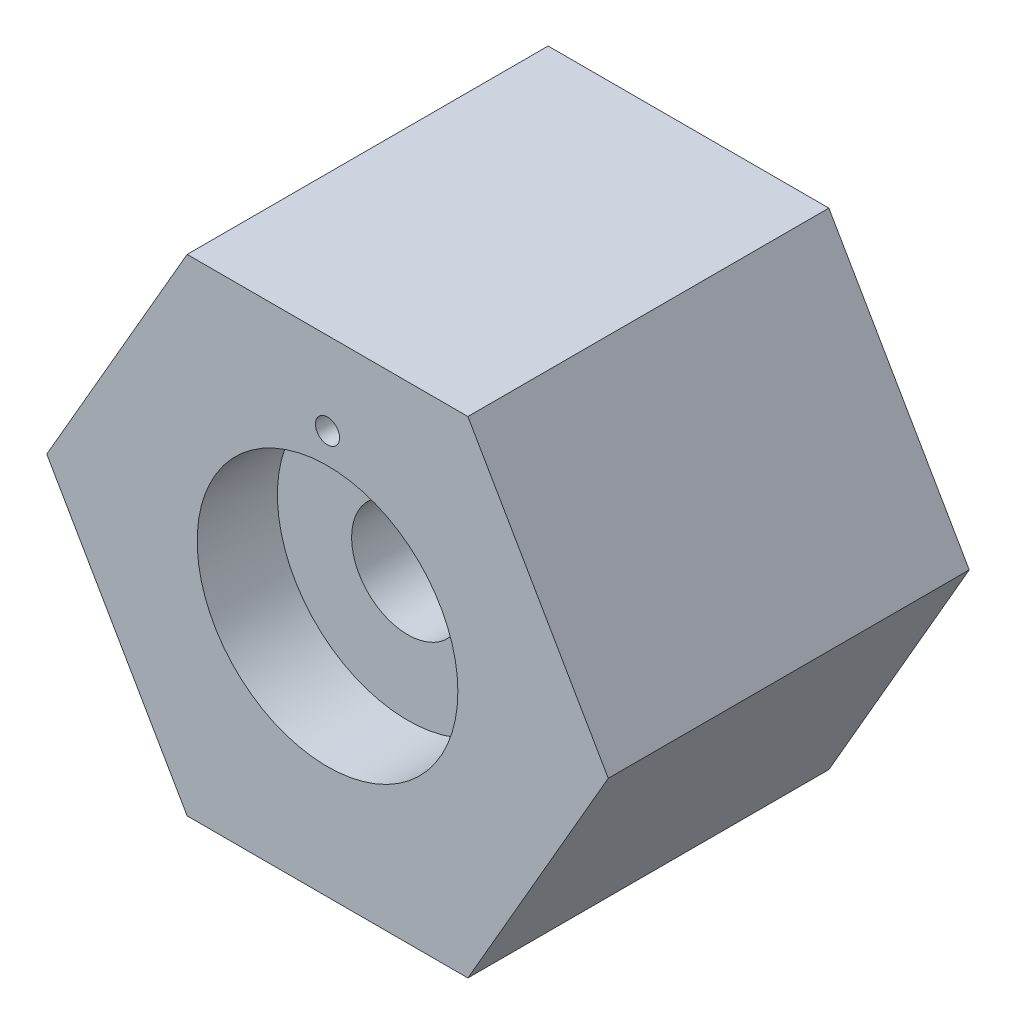
from build123d import *

# Parameters (mm, degrees)
BOSS_EXTRUDE1_DEPTH = 22.5
SKETCH2_R           = 16.25
CUT_EXTRUDE1_DEPTH  = 10
SKETCH3_R           = 7
CUT_EXTRUDE2_DEPTH  = 25
SKETCH4_R           = 1.5
CUT_EXTRUDE4_DEPTH  = 10


with BuildPart() as part:
    # Sketch1 → Boss-Extrude1 (new, symmetric)
    with BuildSketch(Plane.XY):
        Polygon((-17.5, 30.310889132), (17.5, 30.310889132), (35, 0), (17.5, -30.310889132), (-17.5, -30.310889132), (-35, 0), align=None)
    extrude(amount=BOSS_EXTRUDE1_DEPTH, both=True)

    # Sketch2 → Cut-Extrude1 (cut)
    with BuildSketch(Plane.XY.offset(22.5)):
        Circle(SKETCH2_R)
    cut_extrude1 = extrude(amount=-CUT_EXTRUDE1_DEPTH, mode=Mode.SUBTRACT)

    # Mirror1: Cut-Extrude1 across plane
    add(cut_extrude1.mirror(Plane.XY), mode=Mode.SUBTRACT)

    # Sketch3 → Cut-Extrude2 (cut)
    with BuildSketch(Plane(origin=(0, 0, -12.5), x_dir=(-1, 0, 0), z_dir=(0, 0, -1))):
        Circle(SKETCH3_R)
    extrude(amount=-CUT_EXTRUDE2_DEPTH, mode=Mode.SUBTRACT)

    # Sketch4 → Cut-Extrude4 (cut)
    with BuildSketch(Plane.XY.offset(22.5)):
        with Locations((0, 20)):
            Circle(SKETCH4_R)
    cut_extrude4 = extrude(amount=-CUT_EXTRUDE4_DEPTH, mode=Mode.SUBTRACT)

    # Mirror2: Cut-Extrude4 across plane
    add(cut_extrude4.mirror(Plane.XY), mode=Mode.SUBTRACT)


solid = part.part
